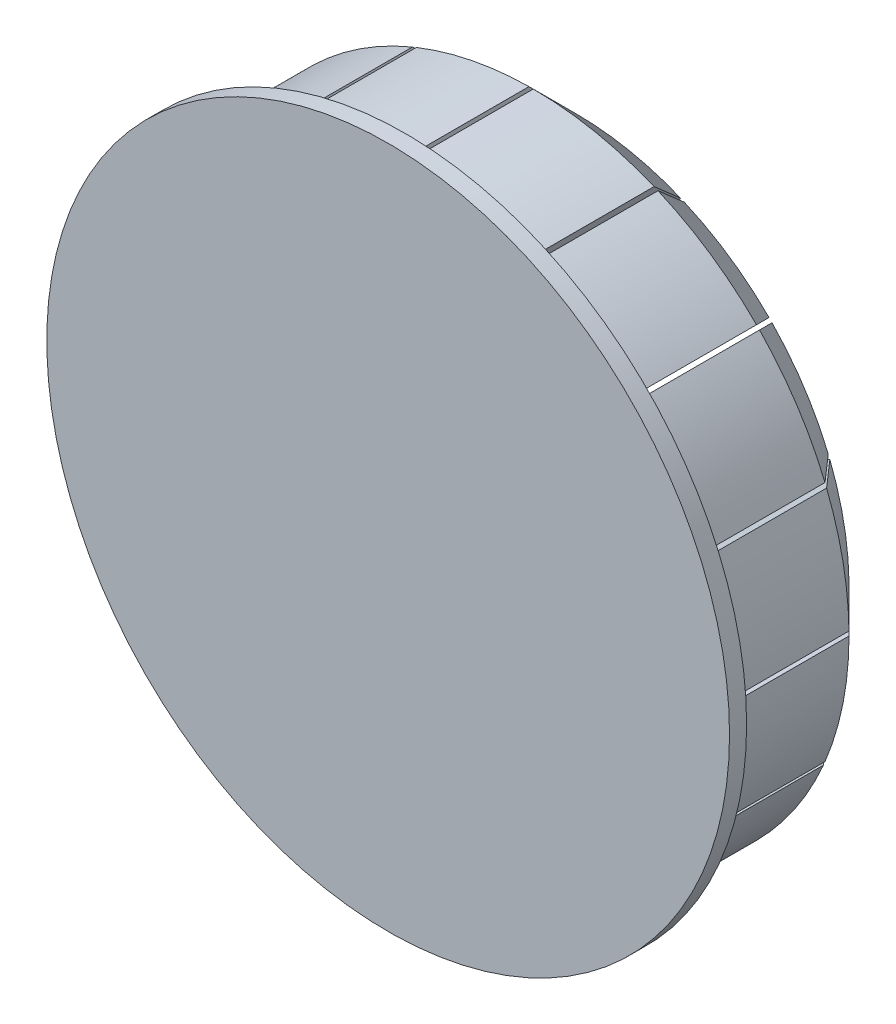
from build123d import *

# Parameters (mm, degrees)
SKETCH1_R            = 40
BOSS_EXTRUDE10_DEPTH = 2
BOSS_EXTRUDE12_START = -2
SKETCH4_R            = 37
BOSS_EXTRUDE12_DEPTH = 2
BOSS_EXTRUDE14_DEPTH = 20
BOSS_EXTRUDE15_DEPTH = 15
CHAMFER6_SIZE        = 5
CHAMFER7_SIZE        = 5
CHAMFER9_SIZE        = 1


with BuildPart() as part:
    # Sketch1 → Boss-Extrude10 (new body)
    with BuildSketch(Plane.XY):
        Circle(SKETCH1_R)
        with BuildLine():
            ThreePointArc((-0.5, 36.996621467), (-0.250005707, 36.999155357), (0, 37))
            ThreePointArc((0, 37), (7.218341915, 36.289055375), (14.159286998, 34.183542703))
            ThreePointArc((14.159286998, 34.183542703), (14.389938923, 34.087089313), (14.619933855, 33.98907963))
            ThreePointArc((14.619933855, 33.98907963), (20.763501512, 30.624777631), (26.162950904, 26.162950904))
            ThreePointArc((26.162950904, 26.162950904), (26.339134382, 25.98557292), (26.514115311, 25.80700853))
            ThreePointArc((26.514115311, 25.80700853), (30.902569089, 20.347757215), (34.183542703, 14.159286998))
            ThreePointArc((34.183542703, 14.159286998), (34.278435397, 13.927988611), (34.371763062, 13.696054323))
            ThreePointArc((34.371763062, 13.696054323), (36.289055375, 7.218341915), (36.996621467, 0.5))
            ThreePointArc((36.996621467, 0.5), (36.999155357, 0.250005707), (37, 0))
            ThreePointArc((37, 0), (36.289055375, -7.218341915), (34.183542703, -14.159286998))
            ThreePointArc((34.183542703, -14.159286998), (34.087089313, -14.389938923), (33.98907963, -14.619933855))
            ThreePointArc((33.98907963, -14.619933855), (30.624777631, -20.763501512), (26.162950904, -26.162950904))
            ThreePointArc((26.162950904, -26.162950904), (25.98557292, -26.339134382), (25.80700853, -26.514115311))
            ThreePointArc((25.80700853, -26.514115311), (20.347757215, -30.902569089), (14.159286998, -34.183542703))
            ThreePointArc((14.159286998, -34.183542703), (13.927988611, -34.278435397), (13.696054323, -34.371763062))
            ThreePointArc((13.696054323, -34.371763062), (6.972975215, -36.337000656), (0, -37))
            ThreePointArc((0, -37), (-0.250005707, -36.999155357), (-0.5, -36.996621467))
            ThreePointArc((-0.5, -36.996621467), (-7.463379051, -36.239453268), (-14.159286998, -34.183542703))
            ThreePointArc((-14.159286998, -34.183542703), (-14.389938923, -34.087089313), (-14.619933855, -33.98907963))
            ThreePointArc((-14.619933855, -33.98907963), (-20.763501512, -30.624777631), (-26.162950904, -26.162950904))
            ThreePointArc((-26.162950904, -26.162950904), (-26.339134382, -25.98557292), (-26.514115311, -25.80700853))
            ThreePointArc((-26.514115311, -25.80700853), (-30.902569089, -20.347757215), (-34.183542703, -14.159286998))
            ThreePointArc((-34.183542703, -14.159286998), (-34.278435397, -13.927988611), (-34.371763062, -13.696054323))
            ThreePointArc((-34.371763062, -13.696054323), (-36.337000656, -6.972975215), (-37, 0))
            ThreePointArc((-37, 0), (-36.999155357, 0.250005707), (-36.996621467, 0.5))
            ThreePointArc((-36.996621467, 0.5), (-36.239453268, 7.463379051), (-34.183542703, 14.159286998))
            ThreePointArc((-34.183542703, 14.159286998), (-34.087089313, 14.389938923), (-33.98907963, 14.619933855))
            ThreePointArc((-33.98907963, 14.619933855), (-30.624777631, 20.763501512), (-26.162950904, 26.162950904))
            ThreePointArc((-26.162950904, 26.162950904), (-25.98557292, 26.339134382), (-25.80700853, 26.514115311))
            ThreePointArc((-25.80700853, 26.514115311), (-20.347757215, 30.902569089), (-14.159286998, 34.183542703))
            ThreePointArc((-14.159286998, 34.183542703), (-13.927988611, 34.278435397), (-13.696054323, 34.371763062))
            ThreePointArc((-13.696054323, 34.371763062), (-7.218341915, 36.289055375), (-0.5, 36.996621467))
        make_face(mode=Mode.SUBTRACT)
    extrude(amount=BOSS_EXTRUDE10_DEPTH)

    # Sketch4 → Boss-Extrude12 (add)
    with BuildSketch(Plane.XY.offset(2).offset(BOSS_EXTRUDE12_START)):
        Circle(SKETCH4_R)
    extrude(amount=BOSS_EXTRUDE12_DEPTH)

    # Sketch1<20> → Boss-Extrude14 (add)
    with BuildSketch(Plane.XY):
        with BuildLine():
            ThreePointArc((14.159286998, 34.183542703), (7.218341915, 36.289055375), (0, 37))
            Line((0, 37), (0, 29.036974883))
            ThreePointArc((0, 29.036974883), (5.66483278, 28.479037552), (11.111969214, 26.82666678))
            Line((11.111969214, 26.82666678), (14.159286998, 34.183542703))
        make_face()
        with BuildLine():
            Line((-0.5, 29.032669707), (-0.5, 36.996621467))
            ThreePointArc((-0.5, 36.996621467), (-7.218341915, 36.289055375), (-13.696054323, 34.371763062))
            Line((-13.696054323, 34.371763062), (-10.648381928, 27.014031033))
            ThreePointArc((-10.648381928, 27.014031033), (-5.66483278, 28.479037552), (-0.5, 29.032669707))
        make_face()
        with BuildLine():
            ThreePointArc((26.162950904, 26.162950904), (20.763501512, 30.624777631), (14.619933855, 33.98907963))
            Line((14.619933855, 33.98907963), (11.572261461, 26.631347601))
            ThreePointArc((11.572261461, 26.631347601), (16.339356042, 24.003569619), (20.532241845, 20.532241845))
            Line((20.532241845, 20.532241845), (26.162950904, 26.162950904))
        make_face()
        with BuildLine():
            Line((-11.111969214, 26.82666678), (-14.159286998, 34.183542703))
            ThreePointArc((-14.159286998, 34.183542703), (-20.347757215, 30.902569089), (-25.80700853, 26.514115311))
            Line((-25.80700853, 26.514115311), (-20.175644235, 20.882751017))
            ThreePointArc((-20.175644235, 20.882751017), (-15.923605825, 24.281365033), (-11.111969214, 26.82666678))
        make_face()
        with BuildLine():
            ThreePointArc((34.183542703, 14.159286998), (30.902569089, 20.347757215), (26.514115311, 25.80700853))
            Line((26.514115311, 25.80700853), (20.882751017, 20.175644235))
            ThreePointArc((20.882751017, 20.175644235), (24.281365033, 15.923605825), (26.82666678, 11.111969214))
            Line((26.82666678, 11.111969214), (34.183542703, 14.159286998))
        make_face()
        with BuildLine():
            Line((-20.532241845, 20.532241845), (-26.162950904, 26.162950904))
            ThreePointArc((-26.162950904, 26.162950904), (-30.624777631, 20.763501512), (-33.98907963, 14.619933855))
            Line((-33.98907963, 14.619933855), (-26.631347601, 11.572261461))
            ThreePointArc((-26.631347601, 11.572261461), (-24.003569619, 16.339356042), (-20.532241845, 20.532241845))
        make_face()
        with BuildLine():
            ThreePointArc((36.996621467, 0.5), (36.289055375, 7.218341915), (34.371763062, 13.696054323))
            Line((34.371763062, 13.696054323), (27.014031033, 10.648381928))
            ThreePointArc((27.014031033, 10.648381928), (28.479037552, 5.66483278), (29.032669707, 0.5))
            Line((29.032669707, 0.5), (36.996621467, 0.5))
        make_face()
        with BuildLine():
            Line((-26.82666678, 11.111969214), (-34.183542703, 14.159286998))
            ThreePointArc((-34.183542703, 14.159286998), (-36.239453268, 7.463379051), (-36.996621467, 0.5))
            Line((-36.996621467, 0.5), (-29.032669707, 0.5))
            ThreePointArc((-29.032669707, 0.5), (-28.429207531, 5.909828211), (-26.82666678, 11.111969214))
        make_face()
        with BuildLine():
            ThreePointArc((34.183542703, -14.159286998), (36.289055375, -7.218341915), (37, 0))
            Line((37, 0), (29.036974883, 0))
            ThreePointArc((29.036974883, 0), (28.479037552, -5.66483278), (26.82666678, -11.111969214))
            Line((26.82666678, -11.111969214), (34.183542703, -14.159286998))
        make_face()
        with BuildLine():
            Line((-29.036974883, 0), (-37, 0))
            ThreePointArc((-37, 0), (-36.337000656, -6.972975215), (-34.371763062, -13.696054323))
            Line((-34.371763062, -13.696054323), (-27.014031033, -10.648381928))
            ThreePointArc((-27.014031033, -10.648381928), (-28.526756308, -5.419417393), (-29.036974883, 0))
        make_face()
        with BuildLine():
            ThreePointArc((26.162950904, -26.162950904), (30.624777631, -20.763501512), (33.98907963, -14.619933855))
            Line((33.98907963, -14.619933855), (26.631347601, -11.572261461))
            ThreePointArc((26.631347601, -11.572261461), (24.003569619, -16.339356042), (20.532241845, -20.532241845))
            Line((20.532241845, -20.532241845), (26.162950904, -26.162950904))
        make_face()
        with BuildLine():
            Line((-26.82666678, -11.111969214), (-34.183542703, -14.159286998))
            ThreePointArc((-34.183542703, -14.159286998), (-30.902569089, -20.347757215), (-26.514115311, -25.80700853))
            Line((-26.514115311, -25.80700853), (-20.882751017, -20.175644235))
            ThreePointArc((-20.882751017, -20.175644235), (-24.281365033, -15.923605825), (-26.82666678, -11.111969214))
        make_face()
        with BuildLine():
            ThreePointArc((14.159286998, -34.183542703), (20.347757215, -30.902569089), (25.80700853, -26.514115311))
            Line((25.80700853, -26.514115311), (20.175644235, -20.882751017))
            ThreePointArc((20.175644235, -20.882751017), (15.923605825, -24.281365033), (11.111969214, -26.82666678))
            Line((11.111969214, -26.82666678), (14.159286998, -34.183542703))
        make_face()
        with BuildLine():
            Line((-20.532241845, -20.532241845), (-26.162950904, -26.162950904))
            ThreePointArc((-26.162950904, -26.162950904), (-20.763501512, -30.624777631), (-14.619933855, -33.98907963))
            Line((-14.619933855, -33.98907963), (-11.572261461, -26.631347601))
            ThreePointArc((-11.572261461, -26.631347601), (-16.339356042, -24.003569619), (-20.532241845, -20.532241845))
        make_face()
        with BuildLine():
            ThreePointArc((0, -37), (6.972975215, -36.337000656), (13.696054323, -34.371763062))
            Line((13.696054323, -34.371763062), (10.648381928, -27.014031033))
            ThreePointArc((10.648381928, -27.014031033), (5.419417393, -28.526756308), (0, -29.036974883))
            Line((0, -29.036974883), (0, -37))
        make_face()
        with BuildLine():
            Line((-11.111969214, -26.82666678), (-14.159286998, -34.183542703))
            ThreePointArc((-14.159286998, -34.183542703), (-7.463379051, -36.239453268), (-0.5, -36.996621467))
            Line((-0.5, -36.996621467), (-0.5, -29.032669707))
            ThreePointArc((-0.5, -29.032669707), (-5.909828211, -28.429207531), (-11.111969214, -26.82666678))
        make_face()
    extrude(amount=-BOSS_EXTRUDE14_DEPTH)

    # Sketch1<21> → Boss-Extrude15 (add)
    with BuildSketch(Plane.XY):
        with BuildLine():
            ThreePointArc((9.963918917, 24.055028183), (5.079561814, 25.536681711), (0, 26.036974883))
            Line((0, 26.036974883), (0, 13.605372115))
            ThreePointArc((0, 13.605372115), (2.654276427, 13.343948705), (5.2065505, 12.56972483))
            Line((5.2065505, 12.56972483), (9.963918917, 24.055028183))
        make_face()
        with BuildLine():
            Line((-0.5, 13.596181464), (-0.5, 26.032173575))
            ThreePointArc((-0.5, 26.032173575), (-5.079561814, 25.536681711), (-9.500141769, 24.241934069))
            Line((-9.500141769, 24.241934069), (-4.741093623, 12.752575491))
            ThreePointArc((-4.741093623, 12.752575491), (-2.654276427, 13.343948705), (-0.5, 13.596181464))
        make_face()
        with BuildLine():
            ThreePointArc((18.410921501, 18.410921501), (14.672578308, 21.509056391), (10.424021302, 23.859250637))
            Line((10.424021302, 23.859250637), (5.664973156, 12.369892059))
            ThreePointArc((5.664973156, 12.369892059), (7.765365652, 11.17162686), (9.620450883, 9.620450883))
            Line((9.620450883, 9.620450883), (18.410921501, 18.410921501))
        make_face()
        with BuildLine():
            Line((-5.2065505, 12.56972483), (-9.963918917, 24.055028183))
            ThreePointArc((-9.963918917, 24.055028183), (-14.256824335, 21.786854315), (-18.053973073, 18.761079855))
            Line((-18.053973073, 18.761079855), (-9.260398721, 9.967505502))
            ThreePointArc((-9.260398721, 9.967505502), (-7.349560619, 11.4494589), (-5.2065505, 12.56972483))
        make_face()
        with BuildLine():
            ThreePointArc((24.055028183, 9.963918917), (21.786854315, 14.256824335), (18.761079855, 18.053973073))
            Line((18.761079855, 18.053973073), (9.967505502, 9.260398721))
            ThreePointArc((9.967505502, 9.260398721), (11.4494589, 7.349560619), (12.56972483, 5.2065505))
            Line((12.56972483, 5.2065505), (24.055028183, 9.963918917))
        make_face()
        with BuildLine():
            Line((-9.620450883, 9.620450883), (-18.410921501, 18.410921501))
            ThreePointArc((-18.410921501, 18.410921501), (-21.509056391, 14.672578308), (-23.859250637, 10.424021302))
            Line((-23.859250637, 10.424021302), (-12.369892059, 5.664973156))
            ThreePointArc((-12.369892059, 5.664973156), (-11.17162686, 7.765365652), (-9.620450883, 9.620450883))
        make_face()
        with BuildLine():
            ThreePointArc((26.032173575, 0.5), (25.536681711, 5.079561814), (24.241934069, 9.500141769))
            Line((24.241934069, 9.500141769), (12.752575491, 4.741093623))
            ThreePointArc((12.752575491, 4.741093623), (13.343948705, 2.654276427), (13.596181464, 0.5))
            Line((13.596181464, 0.5), (26.032173575, 0.5))
        make_face()
        with BuildLine():
            Line((-12.56972483, 5.2065505), (-24.055028183, 9.963918917))
            ThreePointArc((-24.055028183, 9.963918917), (-25.486729592, 5.324535261), (-26.032173575, 0.5))
            Line((-26.032173575, 0.5), (-13.596181464, 0.5))
            ThreePointArc((-13.596181464, 0.5), (-13.292914182, 2.899065877), (-12.56972483, 5.2065505))
        make_face()
        with BuildLine():
            ThreePointArc((24.055028183, -9.963918917), (25.536681711, -5.079561814), (26.036974883, 0))
            Line((26.036974883, 0), (13.605372115, 0))
            ThreePointArc((13.605372115, 0), (13.343948705, -2.654276427), (12.56972483, -5.2065505))
            Line((12.56972483, -5.2065505), (24.055028183, -9.963918917))
        make_face()
        with BuildLine():
            Line((-13.605372115, 0), (-26.036974883, 0))
            ThreePointArc((-26.036974883, 0), (-25.58427925, -4.834120012), (-24.241934069, -9.500141769))
            Line((-24.241934069, -9.500141769), (-12.752575491, -4.741093623))
            ThreePointArc((-12.752575491, -4.741093623), (-13.39047582, -2.408590398), (-13.605372115, 0))
        make_face()
        with BuildLine():
            ThreePointArc((18.410921501, -18.410921501), (21.509056391, -14.672578308), (23.859250637, -10.424021302))
            Line((23.859250637, -10.424021302), (12.369892059, -5.664973156))
            ThreePointArc((12.369892059, -5.664973156), (11.17162686, -7.765365652), (9.620450883, -9.620450883))
            Line((9.620450883, -9.620450883), (18.410921501, -18.410921501))
        make_face()
        with BuildLine():
            Line((-12.56972483, -5.2065505), (-24.055028183, -9.963918917))
            ThreePointArc((-24.055028183, -9.963918917), (-21.786854315, -14.256824335), (-18.761079855, -18.053973073))
            Line((-18.761079855, -18.053973073), (-9.967505502, -9.260398721))
            ThreePointArc((-9.967505502, -9.260398721), (-11.4494589, -7.349560619), (-12.56972483, -5.2065505))
        make_face()
        with BuildLine():
            ThreePointArc((9.963918917, -24.055028183), (14.256824335, -21.786854315), (18.053973073, -18.761079855))
            Line((18.053973073, -18.761079855), (9.260398721, -9.967505502))
            ThreePointArc((9.260398721, -9.967505502), (7.349560619, -11.4494589), (5.2065505, -12.56972483))
            Line((5.2065505, -12.56972483), (9.963918917, -24.055028183))
        make_face()
        with BuildLine():
            Line((-9.620450883, -9.620450883), (-18.410921501, -18.410921501))
            ThreePointArc((-18.410921501, -18.410921501), (-14.672578308, -21.509056391), (-10.424021302, -23.859250637))
            Line((-10.424021302, -23.859250637), (-5.664973156, -12.369892059))
            ThreePointArc((-5.664973156, -12.369892059), (-7.765365652, -11.17162686), (-9.620450883, -9.620450883))
        make_face()
        with BuildLine():
            ThreePointArc((4.741093623, -12.752575491), (2.408590398, -13.39047582), (0, -13.605372115))
            Line((0, -13.605372115), (0, -26.036974883))
            ThreePointArc((0, -26.036974883), (4.834120012, -25.58427925), (9.500141769, -24.241934069))
            Line((9.500141769, -24.241934069), (4.741093623, -12.752575491))
        make_face()
        with BuildLine():
            Line((-0.5, -26.032173575), (-0.5, -13.596181464))
            ThreePointArc((-0.5, -13.596181464), (-2.899065877, -13.292914182), (-5.2065505, -12.56972483))
            Line((-5.2065505, -12.56972483), (-9.963918917, -24.055028183))
            ThreePointArc((-9.963918917, -24.055028183), (-5.324535261, -25.486729592), (-0.5, -26.032173575))
        make_face()
    extrude(amount=-BOSS_EXTRUDE15_DEPTH)

    # Chamfer6
    chamfer6_edges = [part.edges().sort_by_distance(p)[0] for p in [
        (-36.239453268, 7.463379051, -20),
        (-36.337000656, -6.972975215, -20),
        (-30.902569089, -20.347757215, -20),
        (-20.763501512, -30.624777631, -20),
        (-7.463379051, -36.239453268, -20),
        (6.972975215, -36.337000656, -20),
        (20.347757215, -30.902569089, -20),
        (30.624777631, -20.763501512, -20),
        (36.289055375, -7.218341915, -20),
        (36.289055375, 7.218341915, -20),
        (30.902569089, 20.347757215, -20),
        (20.763501512, 30.624777631, -20),
        (7.218341915, 36.289055375, -20),
        (-7.218341915, 36.289055375, -20),
        (-20.347757215, 30.902569089, -20),
        (-30.624777631, 20.763501512, -20),
    ]]
    chamfer(chamfer6_edges, length=CHAMFER6_SIZE)

    # Chamfer7
    chamfer7_edges = [part.edges().sort_by_distance(p)[0] for p in [
        (-5.079561814, 25.536681711, -15),
        (-14.256824335, 21.786854315, -15),
        (-21.509056391, 14.672578308, -15),
        (-25.486729592, 5.324535261, -15),
        (-25.58427925, -4.834120012, -15),
        (-21.786854315, -14.256824335, -15),
        (14.672578308, 21.509056391, -15),
        (21.786854315, 14.256824335, -15),
        (25.536681711, 5.079561814, -15),
        (25.536681711, -5.079561814, -15),
        (21.509056391, -14.672578308, -15),
        (14.256824335, -21.786854315, -15),
        (4.834120012, -25.58427925, -15),
        (-5.324535261, -25.486729592, -15),
        (-14.672578308, -21.509056391, -15),
        (-7.765365652, -11.17162686, -15),
        (-11.4494589, -7.349560619, -15),
        (-13.39047582, -2.408590398, -15),
        (-13.292914182, 2.899065877, -15),
        (-11.17162686, 7.765365652, -15),
        (-7.349560619, 11.4494589, -15),
        (-2.654276427, 13.343948705, -15),
        (-2.899065877, -13.292914182, -15),
        (2.408590398, -13.39047582, -15),
        (7.349560619, -11.4494589, -15),
        (11.17162686, -7.765365652, -15),
        (13.343948705, -2.654276427, -15),
        (13.343948705, 2.654276427, -15),
        (11.4494589, 7.349560619, -15),
        (7.765365652, 11.17162686, -15),
        (2.654276427, 13.343948705, -15),
        (5.079561814, 25.536681711, -15),
    ]]
    chamfer(chamfer7_edges, length=CHAMFER7_SIZE)

    # Chamfer9
    chamfer9_edges = [part.edges().sort_by_distance(p)[0] for p in [
        (-16.339356042, -24.003569619, -20),
        (-24.281365033, -15.923605825, -20),
        (-28.526756308, -5.419417393, -20),
        (-28.429207531, 5.909828211, -20),
        (-24.003569619, 16.339356042, -20),
        (-15.923605825, 24.281365033, -20),
        (5.66483278, 28.479037552, -20),
        (-5.66483278, 28.479037552, -20),
        (16.339356042, 24.003569619, -20),
        (24.281365033, 15.923605825, -20),
        (28.479037552, 5.66483278, -20),
        (28.479037552, -5.66483278, -20),
        (24.003569619, -16.339356042, -20),
        (15.923605825, -24.281365033, -20),
        (5.419417393, -28.526756308, -20),
        (-5.909828211, -28.429207531, -20),
    ]]
    chamfer(chamfer9_edges, length=CHAMFER9_SIZE)


solid = part.part
